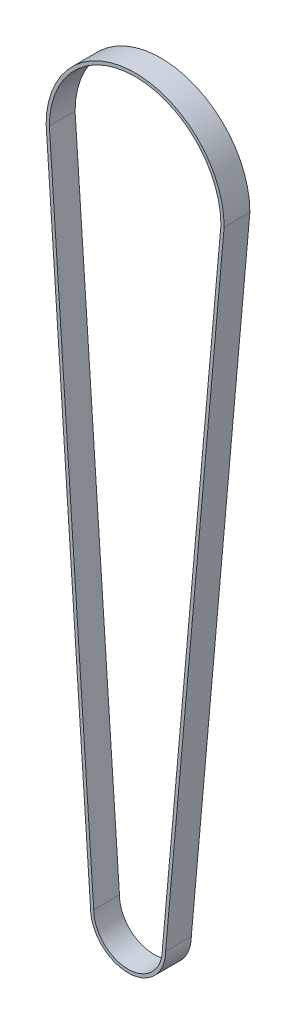
from build123d import *

# Parameters (mm, degrees)
BOSS_EXTRUDE1_DEPTH = 6


with BuildPart() as part:
    # Sketch2 → Boss-Extrude1 (new body)
    with BuildSketch(Plane.XY):
        with BuildLine():
            Line((-20.240452895, 69.876102658), (-9.891367068, -83.165334843))
            ThreePointArc((-9.891367068, -83.165334843), (-1.145521826, -91.88943757), (7.608528051, -83.173567669))
            Line((7.608528051, -83.173567669), (21.259504011, 69.867975582))
            ThreePointArc((21.259504011, 69.867975582), (0.513594902, 90.651664718), (-20.240452895, 69.876102658))
        make_face()
        with BuildLine():
            Line((-19.49046864, 69.901665116), (-9.141405389, -83.139438539))
            ThreePointArc((-9.141405389, -83.139438539), (-1.141405389, -91.139438539), (6.858594611, -83.139438539))
            Line((6.858594611, -83.139438539), (20.50953136, 69.901665116))
            ThreePointArc((20.50953136, 69.901665116), (0.50953136, 89.901665116), (-19.49046864, 69.901665116))
        make_face(mode=Mode.SUBTRACT)
    extrude(amount=BOSS_EXTRUDE1_DEPTH)


solid = part.part
